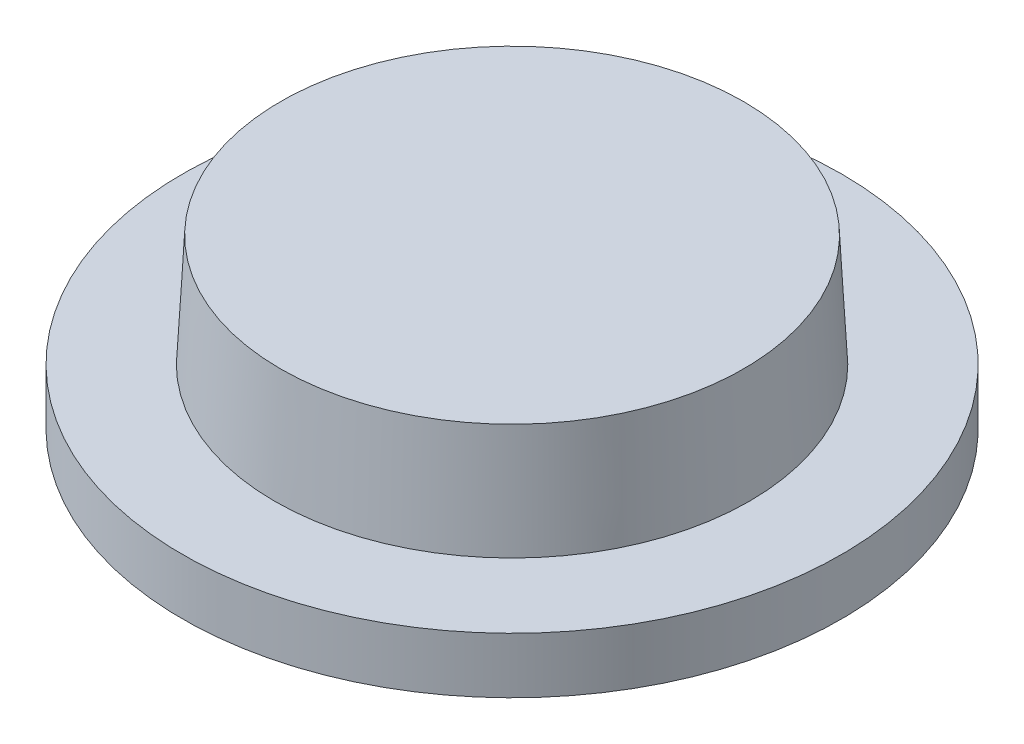
from build123d import *

# Parameters (mm, degrees)
SKETCH1_R           = 2.125
BOSS_EXTRUDE1_DEPTH = 1
BOSS_EXTRUDE1_TAPER = 3
SKETCH2_R           = 2.95
BOSS_EXTRUDE2_DEPTH = 0.5


with BuildPart() as part:
    # Sketch1 → Boss-Extrude1 (new body)
    with BuildSketch(Plane(origin=(0, 0, 0), x_dir=(1, 0, 0), z_dir=(0, 1, 0))):
        Circle(SKETCH1_R)
    extrude(amount=BOSS_EXTRUDE1_DEPTH, taper=BOSS_EXTRUDE1_TAPER)

    # Sketch2 → Boss-Extrude2 (add)
    with BuildSketch(Plane.XZ):
        with Locations(Location((0, 0, 0), (0, 0, 270))):
            Circle(SKETCH2_R)
    extrude(amount=BOSS_EXTRUDE2_DEPTH)


solid = part.part
